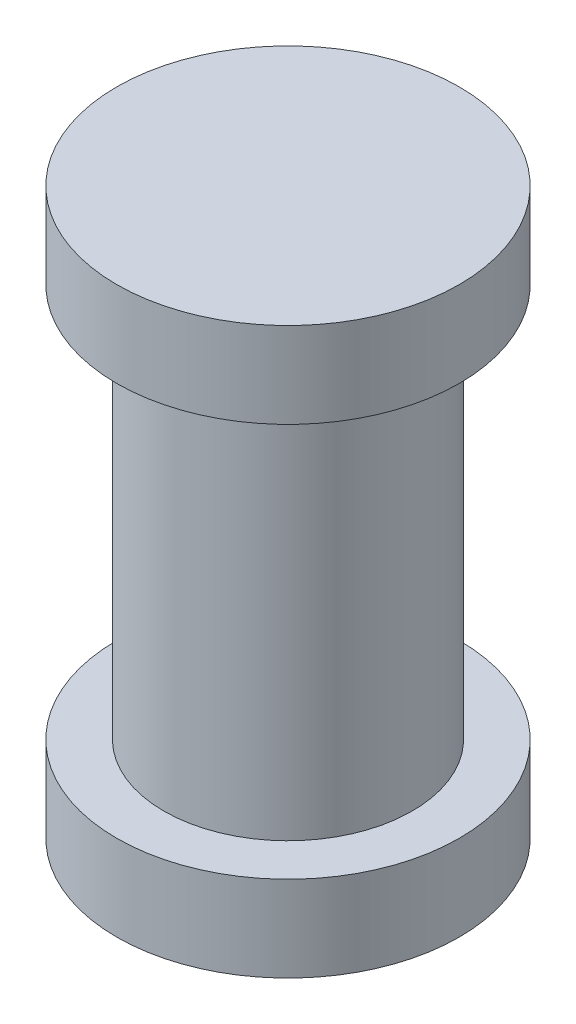
from build123d import *

# Parameters (mm, degrees)
SKETCH1_R      = 1.45
MID_BODY_DEPTH = 2.3
SKETCH2_R      = 2
TOP_HEAD_DEPTH = 1


with BuildPart() as part:
    # Sketch1 → MID BODY (new, symmetric)
    with BuildSketch(Plane(origin=(0, 0, 0), x_dir=(1, 0, 0), z_dir=(0, 1, 0))):
        with Locations(Location((0, 0, 0), (0, 0, 270))):
            Circle(SKETCH1_R)
    extrude(amount=MID_BODY_DEPTH, both=True)

    # Sketch2 → TOP HEAD (add)
    with BuildSketch(Plane(origin=(0, 2.3, 0), x_dir=(1, 0, 0), z_dir=(0, 1, 0))):
        with Locations(Location((0, 0, 0), (0, 0, 270))):
            Circle(SKETCH2_R)
    top_head = extrude(amount=TOP_HEAD_DEPTH)

    # BOTTOM HEAD: TOP HEAD across plane
    add(top_head.mirror(Plane.ZX))


solid = part.part
